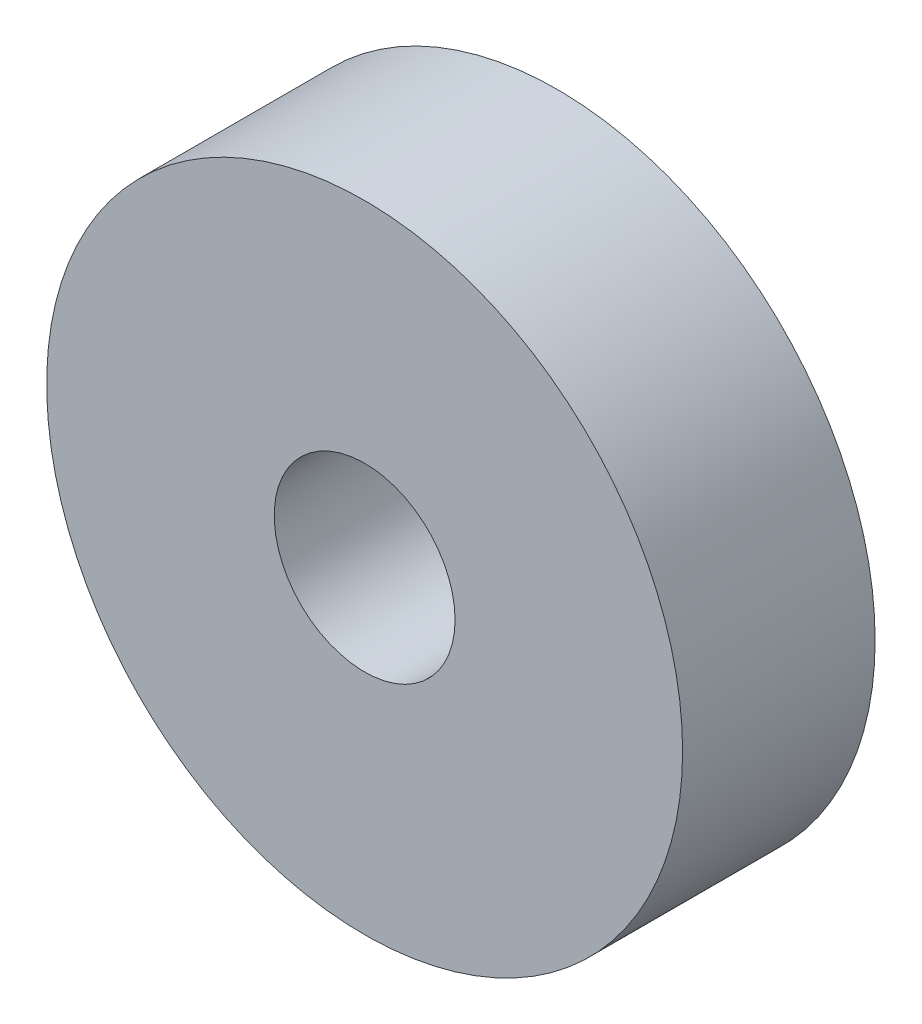
from build123d import *

# Parameters (mm, degrees)
SKETCH_1_R          = 10.9
EXTRUDE_1_DEPTH     = 6.6
SKETCH_2_R          = 3.1
CUT_EXTRUDE_1_DEPTH = 17.768422705


with BuildPart() as part:
    # 草图1 → 凸台-拉伸1 (new body)
    with BuildSketch(Plane.XY):
        Circle(SKETCH_1_R)
    extrude(amount=EXTRUDE_1_DEPTH)

    # 草图2 → 切除-拉伸1 (cut, through all)
    with BuildSketch(Plane.XY.offset(6.6)):
        Circle(SKETCH_2_R)
    extrude(amount=-CUT_EXTRUDE_1_DEPTH, mode=Mode.SUBTRACT)


solid = part.part
